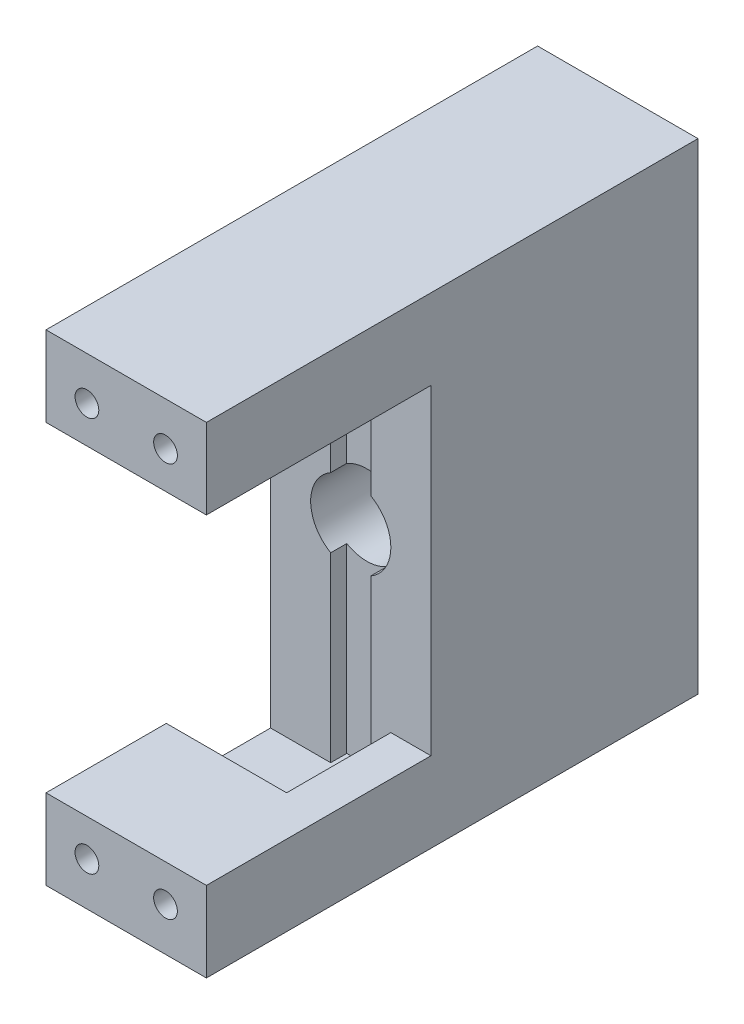
from build123d import *

# Parameters (mm, degrees)
EXTRUDE_1_DEPTH      = 14
CUT_EXTRUDE_1_DEPTH  = 44
SKETCH_3_W           = 6.2
SKETCH_3_H           = 6.2
CUT_EXTRUDE_2_DEPTH  = 4
SKETCH_4_R           = 4
CUT_EXTRUDE_3_DEPTH  = 5
SKETCH_5_R           = 2.6
CUT_EXTRUDE_4_DEPTH  = 5
CUT_EXTRUDE_5_DEPTH  = 50
EXTRUDE_2_DEPTH      = 8
EXTRUDE_3_DEPTH      = 8
SKETCH_10_W          = 20
SKETCH_10_H          = 10
EXTRUDE_4_DEPTH      = 18
SKETCH_12_R          = 1.48
CUT_EXTRUDE_6_DEPTH  = 20
SKETCH_13_W          = 4
SKETCH_13_H          = 40
CUT_EXTRUDE_7_DEPTH  = 22
SKETCH_16_R          = 5
CUT_EXTRUDE_8_DEPTH  = 3
SKETCH_17_R          = 5
CUT_EXTRUDE_9_DEPTH  = 3
SKETCH_18_R          = 2.6
CUT_EXTRUDE_10_DEPTH = 99
SKETCH_19_R          = 5
EXTRUDE_5_DEPTH      = 6
SKETCH_20_W          = 6.2
SKETCH_20_H          = 6.2
CUT_EXTRUDE_11_DEPTH = 4
SKETCH_21_W          = 6.2
SKETCH_21_H          = 6.2
EXTRUDE_6_DEPTH      = 4
SKETCH_22_W          = 0.05
SKETCH_22_H          = 60
CUT_EXTRUDE_12_DEPTH = 4
EXTRUDE_START        = 6
SKETCH_25_W          = 20
SKETCH_25_H          = 10
SKETCH_25_R          = 1.48
EXTRUDE_7_DEPTH      = 6
CUT_EXTRUDE_13_DEPTH = 7
SKETCH_28_W          = 8
SKETCH_28_H          = 10
EXTRUDE_8_DEPTH      = 20
CUT_EXTRUDE_14_DEPTH = 7
SKETCH_30_W          = 6
SKETCH_30_H          = 2.9827115
SKETCH_30_H_2        = 3.265133333
EXTRUDE_9_DEPTH      = 7
SKETCH_31_W          = 6
SKETCH_31_H          = 2
EXTRUDE_10_DEPTH     = 10
SKETCH_32_W          = 6.1
SKETCH_32_H          = 3
CUT_EXTRUDE_15_DEPTH = 10
SKETCH_33_W          = 6.1
SKETCH_33_H          = 3
CUT_EXTRUDE_16_DEPTH = 4
SKETCH_34_W          = 10
SKETCH_34_H          = 5
CUT_EXTRUDE_17_DEPTH = 6
SKETCH_35_W          = 1
SKETCH_35_H          = 5
CUT_EXTRUDE_18_DEPTH = 14
SKETCH_36_W          = 6
SKETCH_36_H          = 5
EXTRUDE_11_DEPTH     = 6
SKETCH_37_W          = 8
SKETCH_37_H          = 1
CUT_EXTRUDE_19_DEPTH = 2
SKETCH_38_R          = 5
EXTRUDE_12_DEPTH     = 6
SKETCH_39_R          = 2.6
CUT_EXTRUDE_20_DEPTH = 10
SKETCH_40_R          = 5
CUT_EXTRUDE_21_DEPTH = 3
EXTRUDE_START_2      = 1
SKETCH_41_W          = 20
SKETCH_41_H          = 40
SKETCH_41_R          = 5
EXTRUDE_13_DEPTH     = 1
SKETCH_42_W          = 20
SKETCH_42_H          = 10
SKETCH_42_R          = 1.48
EXTRUDE_14_DEPTH     = 1
SKETCH_43_W          = 5
SKETCH_43_H          = 5
CUT_EXTRUDE_22_DEPTH = 15
EXTRUDE_15_DEPTH     = 2
SKETCH_45_W          = 6.1
SKETCH_45_H          = 18.1
EXTRUDE_16_DEPTH     = 10
CUT_EXTRUDE_START    = -4
CUT_EXTRUDE_23_DEPTH = 4
SKETCH_47_W          = 15
SKETCH_47_H          = 7.002427308
EXTRUDE_17_DEPTH     = 4
CUT_EXTRUDE_24_DEPTH = 1
SKETCH_49_W          = 2
SKETCH_49_H          = 1
CUT_EXTRUDE_27_DEPTH = 12.5
SKETCH_51_W          = 5
SKETCH_51_H          = 1
EXTRUDE_18_DEPTH     = 1
CUT_EXTRUDE_28_DEPTH = 5
EXTRUDE_19_DEPTH     = 7.5
SKETCH_54_W          = 6.95
SKETCH_54_H          = 2
CUT_EXTRUDE_29_DEPTH = 7.5
SKETCH_55_W          = 6.1
SKETCH_55_H          = 3
CUT_EXTRUDE_30_DEPTH = 4
SKETCH_56_W          = 0.55
SKETCH_56_H          = 0.142857143
EXTRUDE_20_DEPTH     = 4
SKETCH_60_W          = 26.3
SKETCH_60_H          = 60
EXTRUDE_21_DEPTH     = 20
EXTRUDE_22_DEPTH     = 4
SKETCH_62_R          = 2.6
CUT_EXTRUDE_31_DEPTH = 50
SKETCH_63_R          = 5
CUT_EXTRUDE_32_DEPTH = 30.3
CUT_EXTRUDE_33_DEPTH = 4
CUT_EXTRUDE_34_DEPTH = 2
SKETCH_66_W          = 5
SKETCH_66_H          = 2
CUT_EXTRUDE_35_DEPTH = 50
CUT_EXTRUDE_36_DEPTH = 4
SKETCH_68_W          = 5
SKETCH_68_H          = 2
CUT_EXTRUDE_37_DEPTH = 2


with BuildPart() as part:
    # 草图1 → 凸台-拉伸1 (new body)
    with BuildSketch(Plane.XY):
        Polygon((-15, 22), (-15, -22), (15, -22), (15, 22), (0, 22), align=None)
    extrude(amount=EXTRUDE_1_DEPTH)

    # 草图2 → 切除-拉伸1 (cut)
    with BuildSketch(Plane(origin=(0, 22, 0), x_dir=(1, 0, 0), z_dir=(0, 1, 0))):
        Polygon((-15, 0), (-15, -14), (-10, -4), (-3.1, -4), (-3.1, 0), align=None)
        Polygon((3.1, -4), (10, -4), (15, -14), (15, 0), (3.1, 0), align=None)
    extrude(amount=-CUT_EXTRUDE_1_DEPTH, mode=Mode.SUBTRACT)

    # 草图3 → 切除-拉伸2 (cut)
    with BuildSketch(Plane(origin=(0, 0, 0), x_dir=(-1, 0, 0), z_dir=(0, 0, -1))):
        Rectangle(SKETCH_3_W, SKETCH_3_H)
    extrude(amount=-CUT_EXTRUDE_2_DEPTH, mode=Mode.SUBTRACT)

    # 草图4 → 切除-拉伸3 (cut)
    with BuildSketch(Plane.XY.offset(14)):
        Circle(SKETCH_4_R)
    extrude(amount=-CUT_EXTRUDE_3_DEPTH, mode=Mode.SUBTRACT)

    # 草图5 → 切除-拉伸4 (cut)
    with BuildSketch(Plane.XY.offset(9)):
        Circle(SKETCH_5_R)
    extrude(amount=-CUT_EXTRUDE_4_DEPTH, mode=Mode.SUBTRACT)

    # 草图6 → 切除-拉伸5 (cut)
    with BuildSketch(Plane.XZ.offset(22)):
        Polygon((-10, 4), (-15, 14), (-10, 14), align=None)
        Polygon((10, 4), (10, 14), (15, 14), align=None)
    extrude(amount=-CUT_EXTRUDE_5_DEPTH, mode=Mode.SUBTRACT)

    # 草图8 → 凸台-拉伸2 (add)
    with BuildSketch(Plane(origin=(0, -22, 0), x_dir=(-1, 0, 0), z_dir=(0, -1, 0))):
        Polygon((10, -14), (-10, -14), (-10, -4), (-3.1, -4), (-3.1, 0), (3.1, 0), (3.1, -4), (10, -4), align=None)
    extrude(amount=EXTRUDE_2_DEPTH)

    # 草图9 → 凸台-拉伸3 (add)
    with BuildSketch(Plane(origin=(0, 22, 0), x_dir=(1, 0, 0), z_dir=(0, 1, 0))):
        Polygon((-3.1, -4), (-3.1, 0), (3.1, 0), (3.1, -4), (10, -4), (10, -14), (-10, -14), (-10, -4), align=None)
    extrude(amount=EXTRUDE_3_DEPTH)

    # 草图10 → 凸台-拉伸4 (add)
    with BuildSketch(Plane.XY.offset(14)):
        with Locations((0, 25)):
            Rectangle(SKETCH_10_W, SKETCH_10_H)
        with Locations((0, -25)):
            Rectangle(SKETCH_10_W, SKETCH_10_H)
    extrude(amount=EXTRUDE_4_DEPTH)

    # 草图12 → 切除-拉伸6 (cut)
    with BuildSketch(Plane.XY.offset(32)):
        with Locations((-4.9, -24.6)):
            Circle(SKETCH_12_R)
        with Locations((4.9, -24.6)):
            Circle(SKETCH_12_R)
        with Locations((-4.9, 24.6)):
            Circle(SKETCH_12_R)
        with Locations((4.9, 24.6)):
            Circle(SKETCH_12_R)
    extrude(amount=-CUT_EXTRUDE_6_DEPTH, mode=Mode.SUBTRACT)

    # 草图13 → 切除-拉伸7 (cut)
    with BuildSketch(Plane(origin=(10, 0, 0), x_dir=(0, 0, -1), z_dir=(1, 0, 0))):
        with Locations((-12, 0)):
            Rectangle(SKETCH_13_W, SKETCH_13_H)
    extrude(amount=-CUT_EXTRUDE_7_DEPTH, mode=Mode.SUBTRACT)

    # 草图16 → 切除-拉伸8 (cut)
    with BuildSketch(Plane.XY.offset(10)):
        Circle(SKETCH_16_R)
    extrude(amount=-CUT_EXTRUDE_8_DEPTH, mode=Mode.SUBTRACT)

    # 草图17 → 切除-拉伸9 (cut)
    with BuildSketch(Plane.XY.offset(10)):
        with Locations((0, 15)):
            Circle(SKETCH_17_R)
        with Locations((0, -15)):
            Circle(SKETCH_17_R)
    extrude(amount=-CUT_EXTRUDE_9_DEPTH, mode=Mode.SUBTRACT)

    # 草图18 → 切除-拉伸10 (cut)
    with BuildSketch(Plane.XY.offset(7)):
        with Locations((0, 15)):
            Circle(SKETCH_18_R)
        with Locations((0, -15)):
            Circle(SKETCH_18_R)
    extrude(amount=-CUT_EXTRUDE_10_DEPTH, mode=Mode.SUBTRACT)

    # 草图19 → 凸台-拉伸5 (add)
    with BuildSketch(Plane.XY.offset(10)):
        Circle(SKETCH_19_R)
    extrude(amount=-EXTRUDE_5_DEPTH)

    # 草图20 → 切除-拉伸11 (cut)
    with BuildSketch(Plane(origin=(0, 0, 0), x_dir=(-1, 0, 0), z_dir=(0, 0, -1))):
        Polygon((0, -11.9), (0, -15), (0, -18.1), (3.1, -18.1), (3.1, -11.9), align=None)
        Polygon((0, -18.1), (0, -15), (0, -11.9), (-3.1, -11.9), (-3.1, -18.1), align=None)
        with Locations((0, 15)):
            Rectangle(SKETCH_20_W, SKETCH_20_H)
    extrude(amount=-CUT_EXTRUDE_11_DEPTH, mode=Mode.SUBTRACT)

    # 草图21 → 凸台-拉伸6 (add)
    with BuildSketch(Plane(origin=(0, 0, 0), x_dir=(-1, 0, 0), z_dir=(0, 0, -1))):
        Rectangle(SKETCH_21_W, SKETCH_21_H)
    extrude(amount=-EXTRUDE_6_DEPTH)

    # 草图22 → 切除-拉伸12 (cut)
    with BuildSketch(Plane(origin=(0, 0, 0), x_dir=(-1, 0, 0), z_dir=(0, 0, -1))):
        with Locations((-3.075, 0)):
            Rectangle(SKETCH_22_W, SKETCH_22_H)
        with Locations((3.075, 0)):
            Rectangle(SKETCH_22_W, SKETCH_22_H)
    extrude(amount=-CUT_EXTRUDE_12_DEPTH, mode=Mode.SUBTRACT)

    # 草图25 → 凸台-拉伸7 (add)
    # profile 1 of 2: a face of its own
    with BuildSketch(Plane.XY.offset(32).offset(EXTRUDE_START)):
        with Locations((0, 25)):
            Rectangle(SKETCH_25_W, SKETCH_25_H)
        with Locations((-4.9, 24.6)):
            Circle(SKETCH_25_R, mode=Mode.SUBTRACT)
        with Locations((4.9, 24.6)):
            Circle(SKETCH_25_R, mode=Mode.SUBTRACT)
    # profile 2 of 2: a face of its own
    with BuildSketch(Plane.XY.offset(32).offset(EXTRUDE_START)):
        with Locations((0, -25)):
            Rectangle(SKETCH_25_W, SKETCH_25_H)
        with Locations((-4.9, -24.6)):
            Circle(SKETCH_25_R, mode=Mode.SUBTRACT)
        with Locations((4.9, -24.6)):
            Circle(SKETCH_25_R, mode=Mode.SUBTRACT)
    extrude(amount=-EXTRUDE_7_DEPTH)

    # 草图27 → 切除-拉伸13 (cut)
    with BuildSketch(Plane(origin=(0, -20, 0), x_dir=(1, 0, 0), z_dir=(0, 1, 0))):
        Polygon((4, -15), (4, -10), (0, -10), (-4, -10), (-4, -15), align=None)
    extrude(amount=-CUT_EXTRUDE_13_DEPTH, mode=Mode.SUBTRACT)

    # 草图28 → 凸台-拉伸8 (add)
    with BuildSketch(Plane.ZY.offset(10)):
        with Locations((14, -25)):
            Rectangle(SKETCH_28_W, SKETCH_28_H)
        with Locations((14, 25)):
            Rectangle(SKETCH_28_W, SKETCH_28_H)
    extrude(amount=-EXTRUDE_8_DEPTH)

    # 草图29 → 切除-拉伸14 (cut)
    with BuildSketch(Plane(origin=(0, -20, 0), x_dir=(1, 0, 0), z_dir=(0, 1, 0))):
        Polygon((4, -20), (4, -10), (0, -10), (-4, -10), (-4, -20), align=None)
    extrude(amount=-CUT_EXTRUDE_14_DEPTH, mode=Mode.SUBTRACT)

    # 草图30 → 凸台-拉伸9 (add)
    with BuildSketch(Plane(origin=(0, -20, 0), x_dir=(1, 0, 0), z_dir=(0, 1, 0))):
        with Locations((-7, -18.50864425)):
            Rectangle(SKETCH_30_W, SKETCH_30_H)
        with Locations((7, -18.367433334)):
            Rectangle(SKETCH_30_W, SKETCH_30_H_2)
    extrude(amount=-EXTRUDE_9_DEPTH)

    # 草图31 → 凸台-拉伸10 (add)
    with BuildSketch(Plane(origin=(0, -20, 0), x_dir=(1, 0, 0), z_dir=(0, 1, 0))):
        with Locations((7, -21)):
            Rectangle(SKETCH_31_W, SKETCH_31_H)
        Polygon((4, -22), (4, -20), (-4, -20), (-10, -20), (-10, -22), align=None)
    extrude(amount=-EXTRUDE_10_DEPTH)

    # 草图32 → 切除-拉伸15 (cut)
    with BuildSketch(Plane(origin=(0, 0, 0), x_dir=(-1, 0, 0), z_dir=(0, 0, -1))):
        with Locations((0, -25.5)):
            Rectangle(SKETCH_32_W, SKETCH_32_H)
    extrude(amount=-CUT_EXTRUDE_15_DEPTH, mode=Mode.SUBTRACT)

    # 草图33 → 切除-拉伸16 (cut)
    with BuildSketch(Plane(origin=(0, 0, 0), x_dir=(-1, 0, 0), z_dir=(0, 0, -1))):
        with Locations((0, -28.5)):
            Rectangle(SKETCH_33_W, SKETCH_33_H)
    extrude(amount=-CUT_EXTRUDE_16_DEPTH, mode=Mode.SUBTRACT)

    # 草图34 → 切除-拉伸17 (cut)
    with BuildSketch(Plane.ZY.offset(10)):
        with Locations((15, -22.5)):
            Rectangle(SKETCH_34_W, SKETCH_34_H)
    extrude(amount=-CUT_EXTRUDE_17_DEPTH, mode=Mode.SUBTRACT)

    # 草图35 → 切除-拉伸18 (cut)
    with BuildSketch(Plane.ZY.offset(10)):
        with Locations((20.5, -22.5)):
            Rectangle(SKETCH_35_W, SKETCH_35_H)
    extrude(amount=-CUT_EXTRUDE_18_DEPTH, mode=Mode.SUBTRACT)

    # 草图36 → 凸台-拉伸11 (add)
    with BuildSketch(Plane.ZY.offset(10)):
        with Locations((13, -22.5)):
            Rectangle(SKETCH_36_W, SKETCH_36_H)
    extrude(amount=-EXTRUDE_11_DEPTH)

    # 草图37 → 切除-拉伸19 (cut)
    with BuildSketch(Plane(origin=(0, -25, 0), x_dir=(1, 0, 0), z_dir=(0, 1, 0))):
        with Locations((0, -20.5)):
            Rectangle(SKETCH_37_W, SKETCH_37_H)
    extrude(amount=-CUT_EXTRUDE_19_DEPTH, mode=Mode.SUBTRACT)

    # 草图38 → 凸台-拉伸12 (add)
    with BuildSketch(Plane.XY.offset(10)):
        with Locations((0, 15)):
            Circle(SKETCH_38_R)
        with Locations((0, -15)):
            Circle(SKETCH_38_R)
    extrude(amount=-EXTRUDE_12_DEPTH)

    # 草图39 → 切除-拉伸20 (cut)
    with BuildSketch(Plane.XY.offset(10)):
        Circle(SKETCH_39_R)
    extrude(amount=-CUT_EXTRUDE_20_DEPTH, mode=Mode.SUBTRACT)

    # 草图40 → 切除-拉伸21 (cut)
    with BuildSketch(Plane.XY.offset(10)):
        Circle(SKETCH_40_R)
    extrude(amount=-CUT_EXTRUDE_21_DEPTH, mode=Mode.SUBTRACT)

    # 草图41 → 凸台-拉伸13 (add)
    with BuildSketch(Plane.XY.offset(10).offset(EXTRUDE_START_2)):
        Rectangle(SKETCH_41_W, SKETCH_41_H)
        Circle(SKETCH_41_R, mode=Mode.SUBTRACT)
    extrude(amount=-EXTRUDE_13_DEPTH)

    # 草图42 → 凸台-拉伸14 (add)
    # profile 1 of 2: a face of its own
    with BuildSketch(Plane.XY.offset(38).offset(EXTRUDE_START_2)):
        with Locations((0, 25)):
            Rectangle(SKETCH_42_W, SKETCH_42_H)
        with Locations((-4.9, 24.6)):
            Circle(SKETCH_42_R, mode=Mode.SUBTRACT)
        with Locations((4.9, 24.6)):
            Circle(SKETCH_42_R, mode=Mode.SUBTRACT)
    # profile 2 of 2: a face of its own
    with BuildSketch(Plane.XY.offset(38).offset(EXTRUDE_START_2)):
        with Locations((0, -25)):
            Rectangle(SKETCH_42_W, SKETCH_42_H)
        with Locations((-4.9, -24.6)):
            Circle(SKETCH_42_R, mode=Mode.SUBTRACT)
        with Locations((4.9, -24.6)):
            Circle(SKETCH_42_R, mode=Mode.SUBTRACT)
    extrude(amount=-EXTRUDE_14_DEPTH)

    # 草图43 → 切除-拉伸22 (cut)
    with BuildSketch(Plane.ZY.offset(10)):
        Polygon((24, -27), (24, -20), (21, -20), (21, -25), (16, -25), (16, -20), (11, -20), (10.997708979, -20), (10.997708979, -27), align=None)
        with Locations((18.5, -22.5)):
            Rectangle(SKETCH_43_W, SKETCH_43_H)
    extrude(amount=-CUT_EXTRUDE_22_DEPTH, mode=Mode.SUBTRACT)

    # 草图44 → 凸台-拉伸15 (add)
    with BuildSketch(Plane(origin=(0, 0, 24), x_dir=(-1, 0, 0), z_dir=(0, 0, -1))):
        with BuildLine():
            Line((-5, -26.076617757), (-5, -23.123382243))
            ThreePointArc((-5, -23.123382243), (-6.38, -24.6), (-5, -26.076617757))
        make_face()
    extrude(amount=EXTRUDE_15_DEPTH)

    # 草图45 → 凸台-拉伸16 (add)
    with BuildSketch(Plane(origin=(0, 0, 0), x_dir=(-1, 0, 0), z_dir=(0, 0, -1))):
        with Locations((0, -20.95)):
            Rectangle(SKETCH_45_W, SKETCH_45_H)
        with Locations((0, 20.95)):
            Rectangle(SKETCH_45_W, SKETCH_45_H)
    extrude(amount=-EXTRUDE_16_DEPTH)

    # 草图46 → 切除-拉伸23 (cut)
    with BuildSketch(Plane(origin=(0, 0, 0), x_dir=(-1, 0, 0), z_dir=(0, 0, -1)).offset(CUT_EXTRUDE_START)):
        with BuildLine():
            Line((0, -2.6), (0, 0))
            Line((0, 0), (0, 2.6))
            ThreePointArc((0, 2.6), (-2.6, 0), (0, -2.6))
        make_face()
        with BuildLine():
            Line((0, 2.6), (0, 0))
            Line((0, 0), (0, -2.6))
            ThreePointArc((0, -2.6), (1.838477631, -1.838477631), (2.6, 0))
            ThreePointArc((2.6, 0), (1.838477631, 1.838477631), (0, 2.6))
        make_face()
        with BuildLine():
            ThreePointArc((0, -2.6), (-2.6, 0), (0, 2.6))
            Line((0, 2.6), (0, 3.05))
            Line((0, 3.05), (-3.05, 3.05))
            Line((-3.05, 3.05), (-3.05, -3.05))
            Line((-3.05, -3.05), (0, -3.05))
            Line((0, -3.05), (0, -2.6))
        make_face()
        with BuildLine():
            Line((0, 3.05), (0, 2.6))
            ThreePointArc((0, 2.6), (1.838477631, 1.838477631), (2.6, 0))
            ThreePointArc((2.6, 0), (1.838477631, -1.838477631), (0, -2.6))
            Line((0, -2.6), (0, -3.05))
            Line((0, -3.05), (3.05, -3.05))
            Line((3.05, -3.05), (3.05, 3.05))
            Line((3.05, 3.05), (0, 3.05))
        make_face()
    extrude(amount=CUT_EXTRUDE_23_DEPTH, mode=Mode.SUBTRACT)

    # 草图47 → 凸台-拉伸17 (add)
    with BuildSketch(Plane.XY.offset(11)):
        with Locations((-2.5, -23.501213654)):
            Rectangle(SKETCH_47_W, SKETCH_47_H)
    extrude(amount=-EXTRUDE_17_DEPTH)

    # 草图48 → 切除-拉伸24 (cut)
    with BuildSketch(Plane.XY.offset(11)):
        with BuildLine():
            Line((-2.5, 20), (-2.5, 4.330127019))
            ThreePointArc((-2.5, 4.330127019), (0, 5), (2.5, 4.330127019))
            Line((2.5, 4.330127019), (2.5, 20))
            Line((2.5, 20), (-2.5, 20))
        make_face()
        with BuildLine():
            Line((-2.5, -27), (0, -27))
            Line((0, -27), (2.5, -27))
            Line((2.5, -27), (2.5, -4.330127019))
            ThreePointArc((2.5, -4.330127019), (0, -5), (-2.5, -4.330127019))
            Line((-2.5, -4.330127019), (-2.5, -27))
        make_face()
    extrude(amount=-CUT_EXTRUDE_24_DEPTH, mode=Mode.SUBTRACT)

    # 草图49 → 切除-拉伸27 (cut)
    with BuildSketch(Plane.ZY.offset(10)):
        with Locations((10, 19.5)):
            Rectangle(SKETCH_49_W, SKETCH_49_H)
        Polygon((9, 20), (11, 20), (4, 30), (4, 27.142857143), align=None)
        Polygon((4, 27.142857143), (4, 30), (4, 31.546618197), (2, 31.546618197), (2, 30), align=None)
    extrude(amount=-CUT_EXTRUDE_27_DEPTH, mode=Mode.SUBTRACT)

    # 草图51 → 凸台-拉伸18 (add)
    with BuildSketch(Plane(origin=(0, 19, 0), x_dir=(1, 0, 0), z_dir=(0, 1, 0))):
        with Locations((0, -9.5)):
            Rectangle(SKETCH_51_W, SKETCH_51_H)
    extrude(amount=EXTRUDE_18_DEPTH)

    # 草图52 → 切除-拉伸28 (cut)
    with BuildSketch(Plane.ZY.offset(2.5)):
        Polygon((9, 20), (10, 19), (10, 20), align=None)
    extrude(amount=-CUT_EXTRUDE_28_DEPTH, mode=Mode.SUBTRACT)

    # 草图53 → 凸台-拉伸19 (add)
    with BuildSketch(Plane.ZY.offset(10)):
        Polygon((11, 20), (4, 30), (2, 30), (9, 20), (9, 19), (11, 19), align=None)
    extrude(amount=-EXTRUDE_19_DEPTH)

    # 草图54 → 切除-拉伸29 (cut)
    with BuildSketch(Plane(origin=(0, 30, 0), x_dir=(1, 0, 0), z_dir=(0, 1, 0))):
        with Locations((-6.525, -3)):
            Rectangle(SKETCH_54_W, SKETCH_54_H)
    extrude(amount=-CUT_EXTRUDE_29_DEPTH, mode=Mode.SUBTRACT)

    # 草图55 → 切除-拉伸30 (cut)
    with BuildSketch(Plane(origin=(0, 0, 0), x_dir=(-1, 0, 0), z_dir=(0, 0, -1))):
        with Locations((0, 28.5)):
            Rectangle(SKETCH_55_W, SKETCH_55_H)
    extrude(amount=-CUT_EXTRUDE_30_DEPTH, mode=Mode.SUBTRACT)

    # 草图56 → 凸台-拉伸20 (add)
    with BuildSketch(Plane(origin=(0, 0, 4), x_dir=(-1, 0, 0), z_dir=(0, 0, -1))):
        with Locations((-2.775, 27.071428572)):
            Rectangle(SKETCH_56_W, SKETCH_56_H)
        Polygon((2.5, 27.142857143), (-2.5, 27.142857143), (-2.5, 27), (3.05, 27), (3.05, 27.142857143), align=None)
    extrude(amount=EXTRUDE_20_DEPTH)

    # 草图60 → 凸台-拉伸21 (add)
    with BuildSketch(Plane.ZY.offset(10)):
        with Locations((-9.15, 0)):
            Rectangle(SKETCH_60_W, SKETCH_60_H)
        Polygon((11, -27), (11, 20), (11, 30), (4, 30), (4, -30), (11, -30), align=None)
    extrude(amount=-EXTRUDE_21_DEPTH)

    # 草图61 → 凸台-拉伸22 (add)
    with BuildSketch(Plane(origin=(0, 0, -22.3), x_dir=(-1, 0, 0), z_dir=(0, 0, -1))):
        Polygon((0, -30), (0, 0), (0, 30), (-3.05, 30), (-3.05, -30), align=None)
        Polygon((0, 30), (0, 0), (0, -30), (3.05, -30), (3.05, 30), align=None)
    extrude(amount=EXTRUDE_22_DEPTH)

    # 草图62 → 切除-拉伸31 (cut)
    with BuildSketch(Plane.XY.offset(11)):
        Circle(SKETCH_62_R)
    extrude(amount=-CUT_EXTRUDE_31_DEPTH, mode=Mode.SUBTRACT)

    # 草图63 → 切除-拉伸32 (cut)
    with BuildSketch(Plane.XY.offset(11)):
        Circle(SKETCH_63_R)
    extrude(amount=-CUT_EXTRUDE_32_DEPTH, mode=Mode.SUBTRACT)

    # 草图64 → 切除-拉伸33 (cut)
    with BuildSketch(Plane(origin=(0, 0, -26.3), x_dir=(-1, 0, 0), z_dir=(0, 0, -1)).offset(CUT_EXTRUDE_START)):
        with BuildLine():
            Line((0, 3.05), (0, 2.6))
            ThreePointArc((0, 2.6), (1.838477631, 1.838477631), (2.6, 0))
            ThreePointArc((2.6, 0), (1.838477631, -1.838477631), (0, -2.6))
            Line((0, -2.6), (0, -3.05))
            Line((0, -3.05), (3.05, -3.05))
            Line((3.05, -3.05), (3.05, 3.05))
            Line((3.05, 3.05), (0, 3.05))
        make_face()
        with BuildLine():
            ThreePointArc((0, -2.6), (-2.6, 0), (0, 2.6))
            Line((0, 2.6), (0, 3.05))
            Line((0, 3.05), (-3.05, 3.05))
            Line((-3.05, 3.05), (-3.05, -3.05))
            Line((-3.05, -3.05), (0, -3.05))
            Line((0, -3.05), (0, -2.6))
        make_face()
    extrude(amount=CUT_EXTRUDE_33_DEPTH, mode=Mode.SUBTRACT)

    # 草图65 → 切除-拉伸34 (cut)
    with BuildSketch(Plane.XY.offset(11)):
        with BuildLine():
            Line((0, 20), (0, 5))
            ThreePointArc((0, 5), (1.294095226, 4.829629131), (2.5, 4.330127019))
            Line((2.5, 4.330127019), (2.5, 20))
            Line((2.5, 20), (0, 20))
        make_face()
        with BuildLine():
            ThreePointArc((-2.5, 4.330127019), (-1.294095226, 4.829629131), (0, 5))
            Line((0, 5), (0, 20))
            Line((0, 20), (-2.5, 20))
            Line((-2.5, 20), (-2.5, 4.330127019))
        make_face()
        with BuildLine():
            ThreePointArc((2.5, -4.330127019), (1.294095226, -4.829629131), (0, -5))
            Line((0, -5), (0, -27))
            Line((0, -27), (2.5, -27))
            Line((2.5, -27), (2.5, -4.330127019))
        make_face()
        with BuildLine():
            Line((0, -27), (0, -5))
            ThreePointArc((0, -5), (-1.294095226, -4.829629131), (-2.5, -4.330127019))
            Line((-2.5, -4.330127019), (-2.5, -27))
            Line((-2.5, -27), (0, -27))
        make_face()
    extrude(amount=-CUT_EXTRUDE_34_DEPTH, mode=Mode.SUBTRACT)

    # 草图66 → 切除-拉伸35 (cut)
    with BuildSketch(Plane.XY.offset(9)):
        with Locations((0, 19)):
            Rectangle(SKETCH_66_W, SKETCH_66_H)
    extrude(amount=-CUT_EXTRUDE_35_DEPTH, mode=Mode.SUBTRACT)

    # 草图67 → 切除-拉伸36 (cut)
    with BuildSketch(Plane(origin=(0, 0, -26.3), x_dir=(-1, 0, 0), z_dir=(0, 0, -1))):
        Polygon((2.5, 20), (2.5, 18), (3.05, 18), (3.05, 30), (-3.05, 30), (-3.05, 18), (-2.5, 18), (-2.5, 20), align=None)
    extrude(amount=-CUT_EXTRUDE_36_DEPTH, mode=Mode.SUBTRACT)

    # 草图68 → 切除-拉伸37 (cut)
    with BuildSketch(Plane.XY.offset(9)):
        with Locations((0, 17)):
            Rectangle(SKETCH_68_W, SKETCH_68_H)
    extrude(amount=-CUT_EXTRUDE_37_DEPTH, mode=Mode.SUBTRACT)


solid = part.part
